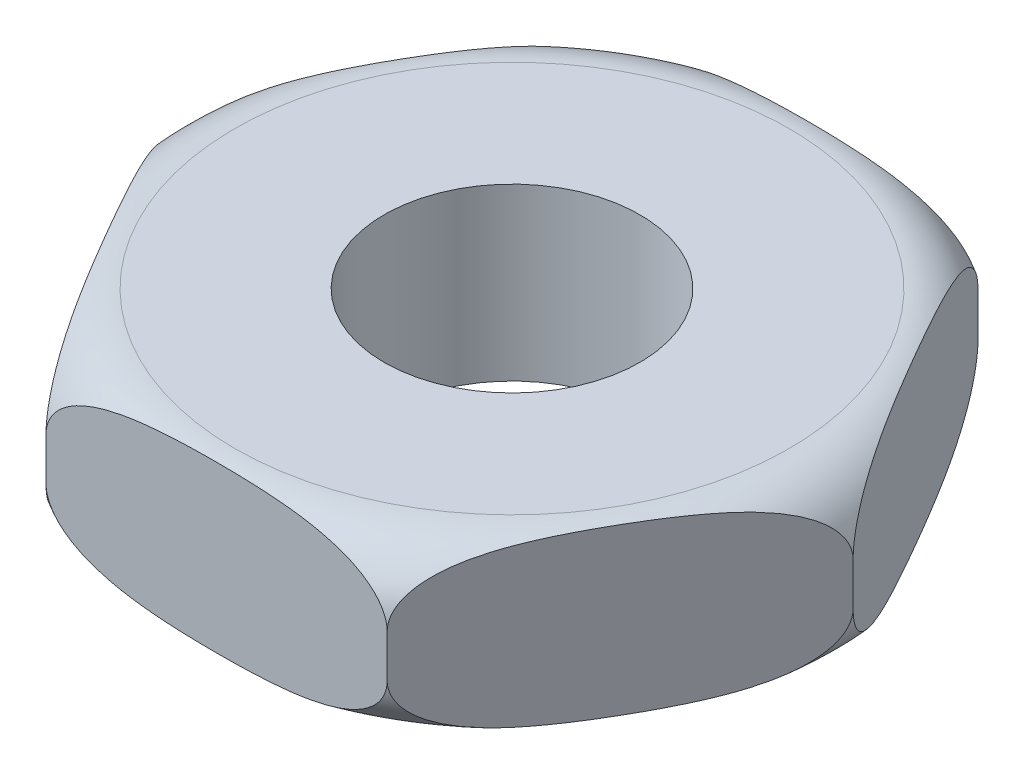
from build123d import *

# Parameters (mm, degrees)
SKETCH1_R           = 6
BOSS_EXTRUDE1_DEPTH = 4


with BuildPart() as part:
    # Sketch1 → Boss-Extrude1 (new, symmetric)
    with BuildSketch(Plane(origin=(0, 0, 0), x_dir=(1, 0, 0), z_dir=(0, 1, 0))):
        Polygon((16, 0), (8, 13.856406461), (-8, 13.856406461), (-16, 0), (-8, -13.856406461), (8, -13.856406461), align=None)
        with Locations(Location((0, 0, 0), (0, 0, 270))):
            Circle(SKETCH1_R, mode=Mode.SUBTRACT)
    extrude(amount=BOSS_EXTRUDE1_DEPTH, both=True)

    # Sketch2 → Cut-Revolve1 (revolve, cut)
    with BuildSketch(Plane.XY, mode=Mode.PRIVATE) as cut_revolve1_sk:
        with BuildLine():
            Line((13, 4), (16, 4))
            Line((16, 4), (16, 1))
            ThreePointArc((16, 1), (15.121320344, 3.121320344), (13, 4))
        make_face()
        with BuildLine():
            Line((13, -4), (16, -4))
            Line((16, -4), (16, -1))
            ThreePointArc((16, -1), (15.121320344, -3.121320344), (13, -4))
        make_face()
    revolve(cut_revolve1_sk.sketch.rotate(Axis((0, 9.369554111, 0), (0, -1, 0)), 90), axis=Axis((0, 9.369554111, 0), (0, -1, 0)), mode=Mode.SUBTRACT)


solid = part.part
